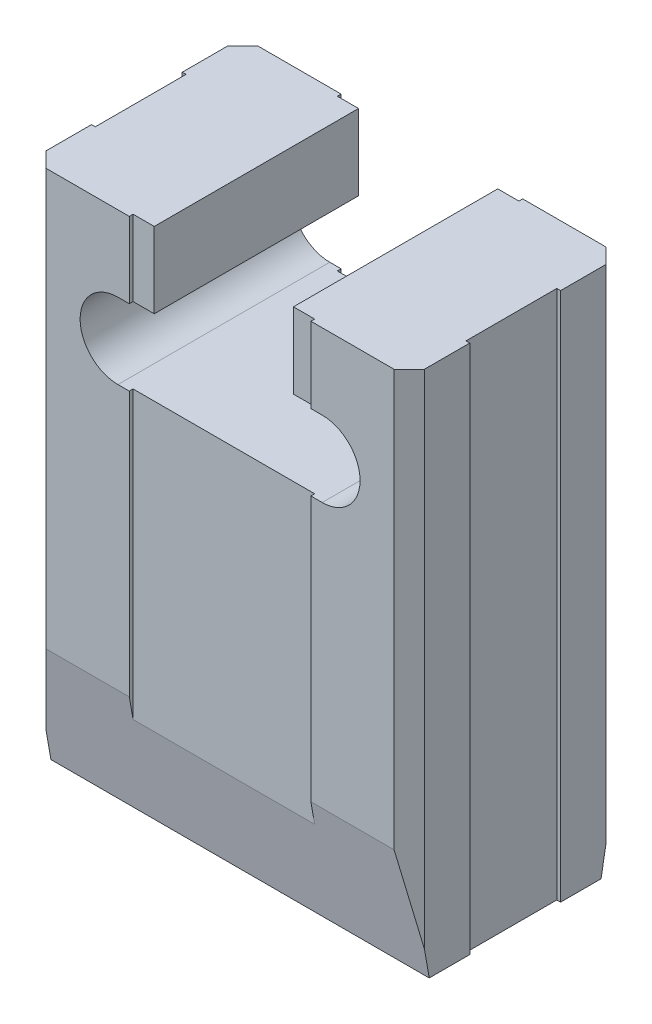
from build123d import *

# Parameters (mm, degrees)
SKETCH_1_W          = 50
SKETCH_1_H          = 70
EXTRUDE_1_DEPTH     = 28
CUT_EXTRUDE_6_DEPTH = 52.322509681
CHAMFER_1_SIZE      = 15
CHAMFER_1_SIZE2     = 2.644904711
CHAMFER_2_SIZE      = 15
CHAMFER_2_SIZE2     = 2.644904711
SKETCH_6_W          = 24
SKETCH_6_H          = 0.5
CUT_EXTRUDE_7_DEPTH = 80.429213769
SKETCH_7_W          = 0.5
SKETCH_7_H          = 12
CUT_EXTRUDE_8_DEPTH = 80.429213769
CHAMFER_3_SIZE      = 2


with BuildPart() as part:
    # 草圖1 → 伸長1 (new body)
    with BuildSketch(Plane.XY):
        Rectangle(SKETCH_1_W, SKETCH_1_H)
    extrude(amount=EXTRUDE_1_DEPTH)

    # 草圖4 → 除料-伸長6 (cut, through all)
    with BuildSketch(Plane.XY.offset(28)):
        with BuildLine():
            Line((-9.2, 35), (-9.2, 25))
            Line((-9.2, 25), (-13.5, 25))
            ThreePointArc((-13.5, 25), (-18.5, 20), (-13.5, 15))
            Line((-13.5, 15), (13.5, 15))
            ThreePointArc((13.5, 15), (18.5, 20), (13.5, 25))
            Line((13.5, 25), (9.2, 25))
            Line((9.2, 25), (9.2, 35))
            Line((9.2, 35), (-9.2, 35))
        make_face()
    extrude(amount=-CUT_EXTRUDE_6_DEPTH, mode=Mode.SUBTRACT)

    # 導角1
    chamfer_1_edges = [part.edges().sort_by_distance(p)[0] for p in [
        (0, -35, 0),
    ]]
    chamfer_1_side = [part.faces().sort_by_distance(p)[0] for p in [
        (0, -4.209254903, 0),
    ]]
    chamfer(chamfer_1_edges, length=CHAMFER_1_SIZE, length2=CHAMFER_1_SIZE2, reference=chamfer_1_side[0])

    # 導角2
    chamfer_2_edges = [part.edges().sort_by_distance(p)[0] for p in [
        (0, -35, 28),
    ]]
    chamfer_2_side = [part.faces().sort_by_distance(p)[0] for p in [
        (0, -4.209254903, 28),
    ]]
    chamfer(chamfer_2_edges, length=CHAMFER_2_SIZE, length2=CHAMFER_2_SIZE2, reference=chamfer_2_side[0])

    # 草圖6 → 除料-伸長7 (cut, through all)
    with BuildSketch(Plane(origin=(0, 35, 0), x_dir=(1, 0, 0), z_dir=(0, 1, 0))):
        with Locations((0, -27.75)):
            Rectangle(SKETCH_6_W, SKETCH_6_H)
        with Locations((0, -0.25)):
            Rectangle(SKETCH_6_W, SKETCH_6_H)
    extrude(amount=-CUT_EXTRUDE_7_DEPTH, mode=Mode.SUBTRACT)

    # 草圖7 → 除料-伸長8 (cut, through all)
    with BuildSketch(Plane(origin=(0, 35, 0), x_dir=(1, 0, 0), z_dir=(0, 1, 0))):
        with Locations((-24.75, -14)):
            Rectangle(SKETCH_7_W, SKETCH_7_H)
        with Locations((24.75, -14)):
            Rectangle(SKETCH_7_W, SKETCH_7_H)
    extrude(amount=-CUT_EXTRUDE_8_DEPTH, mode=Mode.SUBTRACT)

    # 導角3
    chamfer_3_edges = [part.edges().sort_by_distance(p)[0] for p in [
        (-25, 7.5, 28),
        (25, 7.5, 0),
        (25, 7.5, 28),
        (-25, 7.5, 0),
    ]]
    chamfer(chamfer_3_edges, length=CHAMFER_3_SIZE)


solid = part.part
